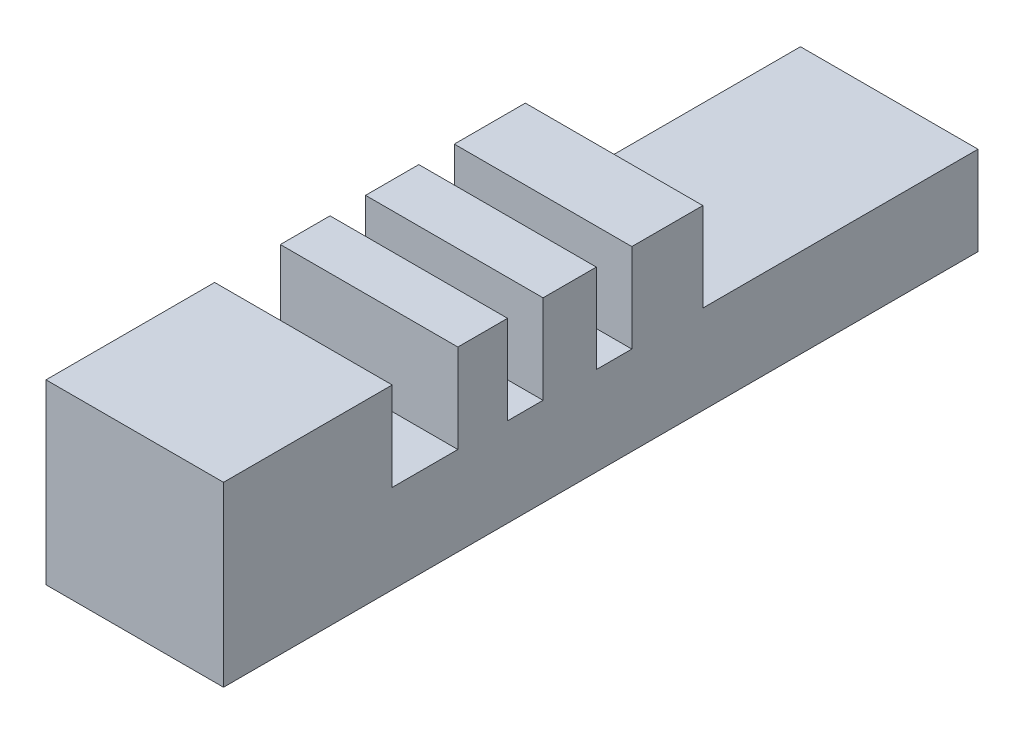
from build123d import *

# Parameters (mm, degrees)
SKETCH1_W           = 10
SKETCH1_H           = 42.5
BOSS_EXTRUDE1_DEPTH = 5
SKETCH2_W           = 10
SKETCH2_H           = 4
BOSS_EXTRUDE2_DEPTH = 5


with BuildPart() as part:
    # Sketch1 → Boss-Extrude1 (new body)
    with BuildSketch(Plane(origin=(0, 0, 0), x_dir=(1, 0, 0), z_dir=(0, 1, 0))):
        with Locations((5, 21.25)):
            Rectangle(SKETCH1_W, SKETCH1_H)
    extrude(amount=BOSS_EXTRUDE1_DEPTH)

    # Sketch2 → Boss-Extrude2 (add)
    with BuildSketch(Plane(origin=(0, 5, 0), x_dir=(1, 0, 0), z_dir=(0, 1, 0))):
        with BuildLine():
            Line((0, 9.5), (0, 0))
            Line((0, 0), (10, 0))
            Line((10, 0), (10, 9.5))
            Line((10, 9.5), (6.38985528, 9.5))
            add(Edge.make_bspline(
                [(6.38985528, 9.5), (6.385913474, 9.499063167), (6.369337183, 9.495284951), (6.339528779, 9.489593982), (6.299971793, 9.48472811), (6.259281687, 9.481095847), (6.231779336, 9.480879047), (6.217848558, 9.480769231)],
                knots=[11.350502485, 11.350502485, 11.350502485, 11.350502485, 11.676244097, 12.717260333, 13.78922464, 14.880174919, 16, 16, 16, 16], degree=3))
            add(Edge.make_bspline(
                [(6.217848558, 9.480769231), (6.19658675, 9.481151208), (6.154913454, 9.481899886), (6.098774023, 9.489476712), (6.064160656, 9.496513578), (6.049680169, 9.5)],
                knots=[0, 0, 0, 0, 1.1129367, 2.181364009, 2.961379824, 2.961379824, 2.961379824, 2.961379824], degree=3))
            Line((6.049680169, 9.5), (5.326923077, 9.5))
            Line((5.326923077, 9.5), (5.192307692, 9.5))
            Line((5.192307692, 9.5), (4.903846154, 9.5))
            Line((4.903846154, 9.5), (4.769230769, 9.5))
            Line((4.769230769, 9.5), (4.12352071, 9.5))
            Line((4.12352071, 9.5), (3.942307692, 9.096153846))
            Line((3.942307692, 9.096153846), (3.796875, 9.096153846))
            Line((3.796875, 9.096153846), (3.978178742, 9.5))
            Line((3.978178742, 9.5), (3.173076923, 9.5))
            Line((3.173076923, 9.5), (3.038461538, 9.5))
            Line((3.038461538, 9.5), (2.466778357, 9.5))
            add(Edge.make_bspline(
                [(2.466778357, 9.5), (2.462836551, 9.499063167), (2.44626026, 9.495284951), (2.416451856, 9.489593982), (2.37689487, 9.48472811), (2.336204764, 9.481095847), (2.308702413, 9.480879047), (2.294771635, 9.480769231)],
                knots=[11.350502485, 11.350502485, 11.350502485, 11.350502485, 11.676244097, 12.717260333, 13.78922464, 14.880174919, 16, 16, 16, 16], degree=3))
            add(Edge.make_bspline(
                [(2.294771635, 9.480769231), (2.273509827, 9.481151208), (2.231836531, 9.481899886), (2.1756971, 9.489476712), (2.141083733, 9.496513578), (2.126603246, 9.5)],
                knots=[0, 0, 0, 0, 1.1129367, 2.181364009, 2.961379824, 2.961379824, 2.961379824, 2.961379824], degree=3))
            Line((2.126603246, 9.5), (1.5, 9.5))
            Line((1.5, 9.5), (1.353665865, 9.5))
            Line((1.353665865, 9.5), (0.223858173, 9.5))
            Line((0.223858173, 9.5), (0.076923077, 9.5))
            Line((0.076923077, 9.5), (0, 9.5))
        make_face()
        with BuildLine():
            add(Edge.make_bspline(
                [(6.38985528, 9.5), (6.385913474, 9.499063167), (6.369337183, 9.495284951), (6.339528779, 9.489593982), (6.299971793, 9.48472811), (6.259281687, 9.481095847), (6.231779336, 9.480879047), (6.217848558, 9.480769231)],
                knots=[11.350502485, 11.350502485, 11.350502485, 11.350502485, 11.676244097, 12.717260333, 13.78922464, 14.880174919, 16, 16, 16, 16], degree=3))
            Line((6.38985528, 9.5), (6.049680169, 9.5))
            add(Edge.make_bspline(
                [(6.217848558, 9.480769231), (6.19658675, 9.481151208), (6.154913454, 9.481899886), (6.098774023, 9.489476712), (6.064160656, 9.496513578), (6.049680169, 9.5)],
                knots=[0, 0, 0, 0, 1.1129367, 2.181364009, 2.961379824, 2.961379824, 2.961379824, 2.961379824], degree=3))
        make_face()
        with BuildLine():
            Line((2.466778357, 9.5), (2.126603246, 9.5))
            add(Edge.make_bspline(
                [(2.294771635, 9.480769231), (2.273509827, 9.481151208), (2.231836531, 9.481899886), (2.1756971, 9.489476712), (2.141083733, 9.496513578), (2.126603246, 9.5)],
                knots=[0, 0, 0, 0, 1.1129367, 2.181364009, 2.961379824, 2.961379824, 2.961379824, 2.961379824], degree=3))
            add(Edge.make_bspline(
                [(2.466778357, 9.5), (2.462836551, 9.499063167), (2.44626026, 9.495284951), (2.416451856, 9.489593982), (2.37689487, 9.48472811), (2.336204764, 9.481095847), (2.308702413, 9.480879047), (2.294771635, 9.480769231)],
                knots=[11.350502485, 11.350502485, 11.350502485, 11.350502485, 11.676244097, 12.717260333, 13.78922464, 14.880174919, 16, 16, 16, 16], degree=3))
        make_face()
        Polygon((3.942307692, 9.096153846), (4.12352071, 9.5), (3.978178742, 9.5), (3.796875, 9.096153846), align=None)
        with BuildLine():
            Line((0, 21), (0, 18))
            Line((0, 18), (10, 18))
            Line((10, 18), (10, 21))
            Line((10, 21), (4.598525657, 21))
            add(Edge.make_bspline(
                [(4.598525657, 21), (4.598135805, 20.999899395), (4.580997325, 20.995497464), (4.545939577, 20.988338664), (4.491951793, 20.98190012), (4.454946287, 20.981152202), (4.435997596, 20.980769231)],
                knots=[8.84081453, 8.84081453, 8.84081453, 8.84081453, 8.864066838, 9.862729781, 10.905609505, 12, 12, 12, 12], degree=3))
            add(Edge.make_bspline(
                [(4.435997596, 20.980769231), (4.414936749, 20.981260877), (4.373853136, 20.982219937), (4.320342805, 20.98961816), (4.288253752, 20.996770904), (4.275833044, 21)],
                knots=[0, 0, 0, 0, 1.145258523, 2.234067595, 2.931969346, 2.931969346, 2.931969346, 2.931969346], degree=3))
            Line((4.275833044, 21), (3.5, 21))
            Line((3.5, 21), (3.365384615, 21))
            Line((3.365384615, 21), (2.923076923, 21))
            Line((2.923076923, 21), (2.788461538, 21))
            Line((2.788461538, 21), (2.497147401, 21))
            add(Edge.make_bspline(
                [(2.497147401, 21), (2.48773707, 20.997577032), (2.45762121, 20.990585666), (2.405483538, 20.982277726), (2.362518243, 20.981276574), (2.340745192, 20.980769231)],
                knots=[5.529312578, 5.529312578, 5.529312578, 5.529312578, 5.985159533, 6.978961417, 8, 8, 8, 8], degree=3))
            add(Edge.make_bspline(
                [(2.340745192, 20.980769231), (2.321387498, 20.981294819), (2.283213267, 20.982331302), (2.232273472, 20.989625468), (2.20103719, 20.996660619), (2.188281559, 21)],
                knots=[0, 0, 0, 0, 1.033919861, 2.038935746, 2.743200613, 2.743200613, 2.743200613, 2.743200613], degree=3))
            Line((2.188281559, 21), (1.5, 21))
            Line((1.5, 21), (1.365384615, 21))
            Line((1.365384615, 21), (0.326923077, 21))
            Line((0.326923077, 21), (0.192307692, 21))
            Line((0.192307692, 21), (0, 21))
        make_face()
        with BuildLine():
            Line((0, 16), (0, 13.2))
            Line((0, 13.2), (10, 13.2))
            Line((10, 13.2), (10, 16))
            Line((10, 16), (3.521033654, 16))
            Line((3.521033654, 16), (3.115384615, 16))
            Line((3.115384615, 16), (2.418932719, 16))
            add(Edge.make_bspline(
                [(2.418932719, 16), (2.411928934, 15.997803198), (2.38964973, 15.991136542), (2.351568812, 15.981497268), (2.304119202, 15.972381089), (2.255531856, 15.966286943), (2.205701909, 15.962111836), (2.172084157, 15.961731301), (2.155048077, 15.961538462)],
                knots=[10.30831536, 10.30831536, 10.30831536, 10.30831536, 10.776456485, 11.791383307, 12.812564526, 13.85620153, 14.913611965, 16, 16, 16, 16], degree=3))
            add(Edge.make_bspline(
                [(2.155048077, 15.961538462), (2.138915077, 15.961650744), (2.107014067, 15.961872769), (2.059914602, 15.965469412), (2.014061924, 15.970376442), (1.969587085, 15.97776507), (1.926247381, 15.986484073), (1.896478302, 15.994805468), (1.881010855, 15.999495178), (1.879360723, 16)],
                knots=[0, 0, 0, 0, 1.114604814, 2.203992996, 3.262667896, 4.300477797, 5.318619304, 6.316056647, 6.435280565, 6.435280565, 6.435280565, 6.435280565], degree=3))
            Line((1.879360723, 16), (0.326923077, 16))
            Line((0.326923077, 16), (0.192307692, 16))
            Line((0.192307692, 16), (0, 16))
        make_face()
        with BuildLine():
            Line((2.418932719, 16), (1.879360723, 16))
            add(Edge.make_bspline(
                [(2.155048077, 15.961538462), (2.138915077, 15.961650744), (2.107014067, 15.961872769), (2.059914602, 15.965469412), (2.014061924, 15.970376442), (1.969587085, 15.97776507), (1.926247381, 15.986484073), (1.896478302, 15.994805468), (1.881010855, 15.999495178), (1.879360723, 16)],
                knots=[0, 0, 0, 0, 1.114604814, 2.203992996, 3.262667896, 4.300477797, 5.318619304, 6.316056647, 6.435280565, 6.435280565, 6.435280565, 6.435280565], degree=3))
            add(Edge.make_bspline(
                [(2.418932719, 16), (2.411928934, 15.997803198), (2.38964973, 15.991136542), (2.351568812, 15.981497268), (2.304119202, 15.972381089), (2.255531856, 15.966286943), (2.205701909, 15.962111836), (2.172084157, 15.961731301), (2.155048077, 15.961538462)],
                knots=[10.30831536, 10.30831536, 10.30831536, 10.30831536, 10.776456485, 11.791383307, 12.812564526, 13.85620153, 14.913611965, 16, 16, 16, 16], degree=3))
        make_face()
        with BuildLine():
            add(Edge.make_bspline(
                [(4.598525657, 21), (4.598135805, 20.999899395), (4.580997325, 20.995497464), (4.545939577, 20.988338664), (4.491951793, 20.98190012), (4.454946287, 20.981152202), (4.435997596, 20.980769231)],
                knots=[8.84081453, 8.84081453, 8.84081453, 8.84081453, 8.864066838, 9.862729781, 10.905609505, 12, 12, 12, 12], degree=3))
            Line((4.598525657, 21), (4.275833044, 21))
            add(Edge.make_bspline(
                [(4.435997596, 20.980769231), (4.414936749, 20.981260877), (4.373853136, 20.982219937), (4.320342805, 20.98961816), (4.288253752, 20.996770904), (4.275833044, 21)],
                knots=[0, 0, 0, 0, 1.145258523, 2.234067595, 2.931969346, 2.931969346, 2.931969346, 2.931969346], degree=3))
        make_face()
        with BuildLine():
            Line((2.497147401, 21), (2.188281559, 21))
            add(Edge.make_bspline(
                [(2.340745192, 20.980769231), (2.321387498, 20.981294819), (2.283213267, 20.982331302), (2.232273472, 20.989625468), (2.20103719, 20.996660619), (2.188281559, 21)],
                knots=[0, 0, 0, 0, 1.033919861, 2.038935746, 2.743200613, 2.743200613, 2.743200613, 2.743200613], degree=3))
            add(Edge.make_bspline(
                [(2.497147401, 21), (2.48773707, 20.997577032), (2.45762121, 20.990585666), (2.405483538, 20.982277726), (2.362518243, 20.981276574), (2.340745192, 20.980769231)],
                knots=[5.529312578, 5.529312578, 5.529312578, 5.529312578, 5.985159533, 6.978961417, 8, 8, 8, 8], degree=3))
        make_face()
        with Locations((5, 25)):
            Rectangle(SKETCH2_W, SKETCH2_H)
    extrude(amount=BOSS_EXTRUDE2_DEPTH)


solid = part.part
